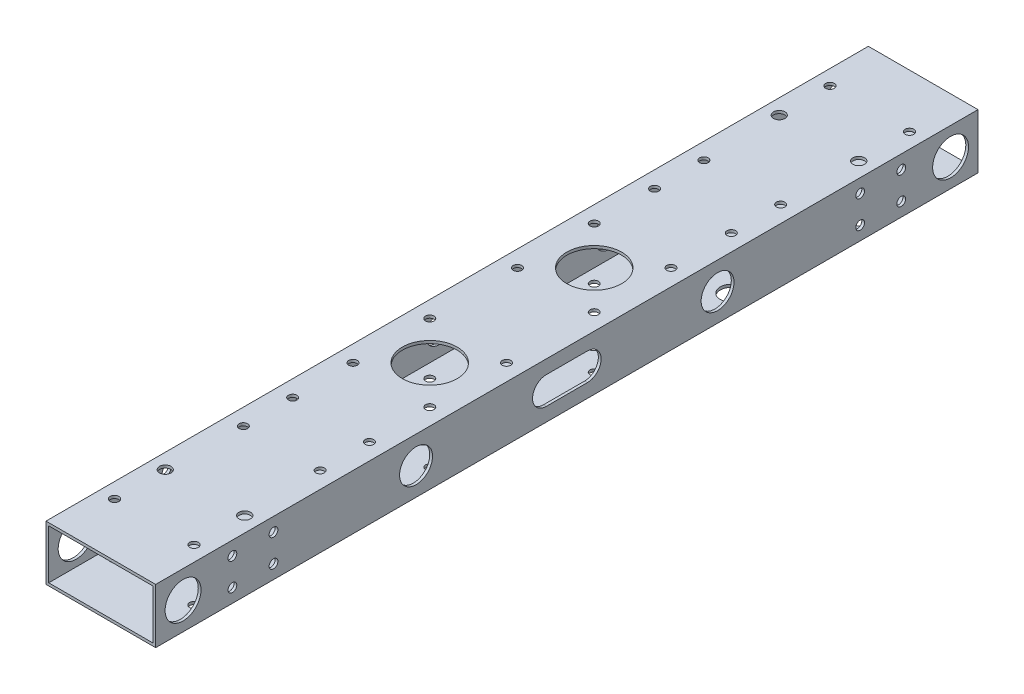
from build123d import *

# Parameters (mm, degrees)
SKETCH_1_W          = 40
SKETCH_1_H          = 20
SKETCH_1_W_2        = 38
SKETCH_1_H_2        = 18
EXTRUDE_1_DEPTH     = 150
SKETCH_2_R          = 6.55
CUT_EXTRUDE_1_DEPTH = 40
SKETCH_3_R          = 1.55
CUT_EXTRUDE_2_DEPTH = 30
SKETCH_4_R          = 4
CUT_EXTRUDE_3_DEPTH = 10
SKETCH_5_R          = 1.6
CUT_EXTRUDE_4_DEPTH = 50
SKETCH_6_R          = 1.6
SKETCH_6_R_2        = 2.1
CUT_EXTRUDE_5_DEPTH = 50
SKETCH_7_R          = 10
SKETCH_7_R_2        = 1.55
CUT_EXTRUDE_6_DEPTH = 30
SKETCH_10_R         = 6
CUT_EXTRUDE_7_DEPTH = 50


with BuildPart() as part:
    # 草图1 → 凸台-拉伸1 (new, symmetric)
    with BuildSketch(Plane.XY):
        Rectangle(SKETCH_1_W, SKETCH_1_H)
        Rectangle(SKETCH_1_W_2, SKETCH_1_H_2, mode=Mode.SUBTRACT)
    extrude(amount=EXTRUDE_1_DEPTH, both=True)

    # 草图2 → 切除-拉伸1 (cut)
    with BuildSketch(Plane(origin=(20, 0, 0), x_dir=(0, 0, -1), z_dir=(1, 0, 0))):
        with Locations((-140, 0)):
            Circle(SKETCH_2_R)
        with Locations((140, 0)):
            Circle(SKETCH_2_R)
    extrude(amount=-CUT_EXTRUDE_1_DEPTH, mode=Mode.SUBTRACT)

    # 草图3 → 切除-拉伸2 (cut)
    with BuildSketch(Plane(origin=(0, 10, 0), x_dir=(1, 0, 0), z_dir=(0, 1, 0))):
        with Locations(Location((-14, -84, 0), (0, 0, 270))):
            Circle(SKETCH_3_R)
        with Locations(Location((-14, -66, 0), (0, 0, 270))):
            Circle(SKETCH_3_R)
        with Locations(Location((14, -84, 0), (0, 0, 270))):
            Circle(SKETCH_3_R)
        with Locations(Location((14, -66, 0), (0, 0, 270))):
            Circle(SKETCH_3_R)
        with Locations(Location((-14, 66, 0), (0, 0, 270))):
            Circle(SKETCH_3_R)
        with Locations(Location((-14, 84, 0), (0, 0, 270))):
            Circle(SKETCH_3_R)
        with Locations(Location((14, 66, 0), (0, 0, 270))):
            Circle(SKETCH_3_R)
        with Locations(Location((14, 84, 0), (0, 0, 270))):
            Circle(SKETCH_3_R)
    extrude(amount=-CUT_EXTRUDE_2_DEPTH, mode=Mode.SUBTRACT)

    # 草图4 → 切除-拉伸3 (cut)
    with BuildSketch(Plane.XZ.offset(10)):
        with Locations(Location((14, -84, 0), (0, 0, 270))):
            Circle(SKETCH_4_R)
        with Locations(Location((14, -66, 0), (0, 0, 270))):
            Circle(SKETCH_4_R)
        with Locations(Location((14, 84, 0), (0, 0, 270))):
            Circle(SKETCH_4_R)
        with Locations(Location((14, 66, 0), (0, 0, 270))):
            Circle(SKETCH_4_R)
    extrude(amount=-CUT_EXTRUDE_3_DEPTH, mode=Mode.SUBTRACT)

    # 草图5 → 切除-拉伸4 (cut)
    with BuildSketch(Plane(origin=(20, 0, 0), x_dir=(0, 0, -1), z_dir=(1, 0, 0))):
        with Locations((122, 5)):
            Circle(SKETCH_5_R)
        with Locations((122, -5)):
            Circle(SKETCH_5_R)
        with Locations((107, 5)):
            Circle(SKETCH_5_R)
        with Locations((107, -5)):
            Circle(SKETCH_5_R)
        with Locations((-107, -5)):
            Circle(SKETCH_5_R)
        with Locations((-107, 5)):
            Circle(SKETCH_5_R)
        with Locations((-122, -5)):
            Circle(SKETCH_5_R)
        with Locations((-122, 5)):
            Circle(SKETCH_5_R)
    extrude(amount=-CUT_EXTRUDE_4_DEPTH, mode=Mode.SUBTRACT)

    # 草图6 → 切除-拉伸5 (cut)
    with BuildSketch(Plane.XZ.offset(10)):
        with Locations(Location((-14.5, -130.5, 0), (0, 0, 270))):
            Circle(SKETCH_6_R)
        with Locations(Location((14.5, -130.5, 0), (0, 0, 270))):
            Circle(SKETCH_6_R)
        with Locations(Location((14.5, -112, 0), (0, 0, 270))):
            Circle(SKETCH_6_R_2)
        with Locations(Location((-14.5, -112, 0), (0, 0, 270))):
            Circle(SKETCH_6_R_2)
        with Locations(Location((-14.5, 112, 0), (0, 0, 90))):
            Circle(SKETCH_6_R_2)
        with Locations(Location((14.5, 112, 0), (0, 0, 90))):
            Circle(SKETCH_6_R_2)
        with Locations(Location((14.5, 130.5, 0), (0, 0, 90))):
            Circle(SKETCH_6_R)
        with Locations(Location((-14.5, 130.5, 0), (0, 0, 90))):
            Circle(SKETCH_6_R)
    extrude(amount=-CUT_EXTRUDE_5_DEPTH, mode=Mode.SUBTRACT)

    # 草图7 → 切除-拉伸6 (cut)
    with BuildSketch(Plane(origin=(0, 10, 0), x_dir=(1, 0, 0), z_dir=(0, 1, 0))):
        with Locations(Location((0, 30, 0), (0, 0, 270))):
            Circle(SKETCH_7_R)
        with Locations(Location((14, 44, 0), (0, 0, 270))):
            Circle(SKETCH_7_R_2)
        with Locations(Location((-14, 44, 0), (0, 0, 270))):
            Circle(SKETCH_7_R_2)
        with Locations(Location((-14, 16, 0), (0, 0, 270))):
            Circle(SKETCH_7_R_2)
        with Locations(Location((14, 16, 0), (0, 0, 270))):
            Circle(SKETCH_7_R_2)
        with Locations(Location((14, -16, 0), (0, 0, 270))):
            Circle(SKETCH_7_R_2)
        with Locations(Location((-14, -16, 0), (0, 0, 270))):
            Circle(SKETCH_7_R_2)
        with Locations(Location((-14, -44, 0), (0, 0, 270))):
            Circle(SKETCH_7_R_2)
        with Locations(Location((14, -44, 0), (0, 0, 270))):
            Circle(SKETCH_7_R_2)
        with Locations(Location((0, -30, 0), (0, 0, 270))):
            Circle(SKETCH_7_R)
    extrude(amount=-CUT_EXTRUDE_6_DEPTH, mode=Mode.SUBTRACT)

    # 草图10 → 切除-拉伸7 (cut)
    with BuildSketch(Plane(origin=(20, 0, 0), x_dir=(0, 0, -1), z_dir=(1, 0, 0))):
        with Locations((55, 0)):
            Circle(SKETCH_10_R)
        with Locations((-55, 0)):
            Circle(SKETCH_10_R)
        with BuildLine():
            Line((-7.5, 5), (7.5, 5))
            ThreePointArc((7.5, 5), (12.5, 0), (7.5, -5))
            Line((7.5, -5), (-7.5, -5))
            ThreePointArc((-7.5, -5), (-12.5, 0), (-7.5, 5))
        make_face()
    extrude(amount=-CUT_EXTRUDE_7_DEPTH, mode=Mode.SUBTRACT)


solid = part.part
